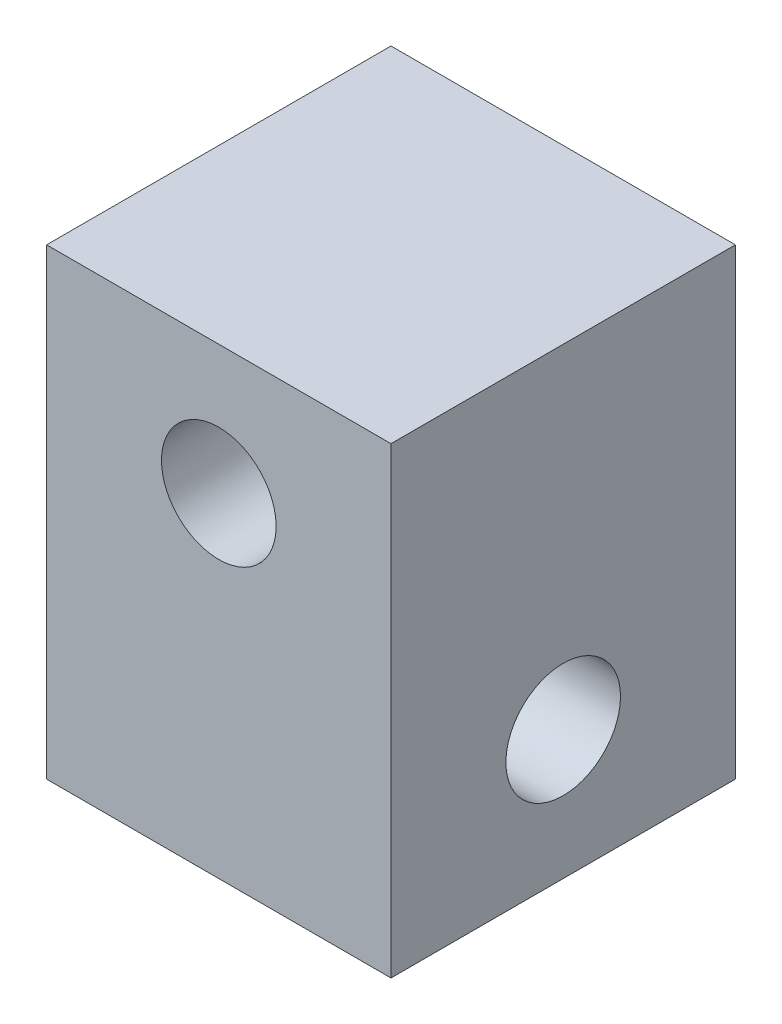
from build123d import *

# Parameters (mm, degrees)
SKETCH1_W              = 10.922
SKETCH1_H              = 8.128
BOSS_EXTRUDE1_DEPTH    = 8.128
M2_5_CLEARANCE_HOLE1_D = 2.7051
M2_5_CLEARANCE_HOLE2_D = 2.7051


with BuildPart() as part:
    # Sketch1 → Boss-Extrude1 (new body)
    with BuildSketch(Plane(origin=(-4.064, 0, 0), x_dir=(0, -1, 0), z_dir=(-1, 0, 0))):
        with Locations((-5.461, 0)):
            Rectangle(SKETCH1_W, SKETCH1_H)
    extrude(amount=-BOSS_EXTRUDE1_DEPTH)

    # M2.5 Clearance Hole1 (through all)
    with Locations(Plane(origin=(4.064, 0, 0), x_dir=(0, 0, -1), z_dir=(1, 0, 0))):
        with Locations((0, 3.048)):
            Hole(M2_5_CLEARANCE_HOLE1_D / 2)

    # M2.5 Clearance Hole2 (through all)
    with Locations(Plane.XY.offset(4.064)):
        with Locations((0, 7.874)):
            Hole(M2_5_CLEARANCE_HOLE2_D / 2)


solid = part.part
